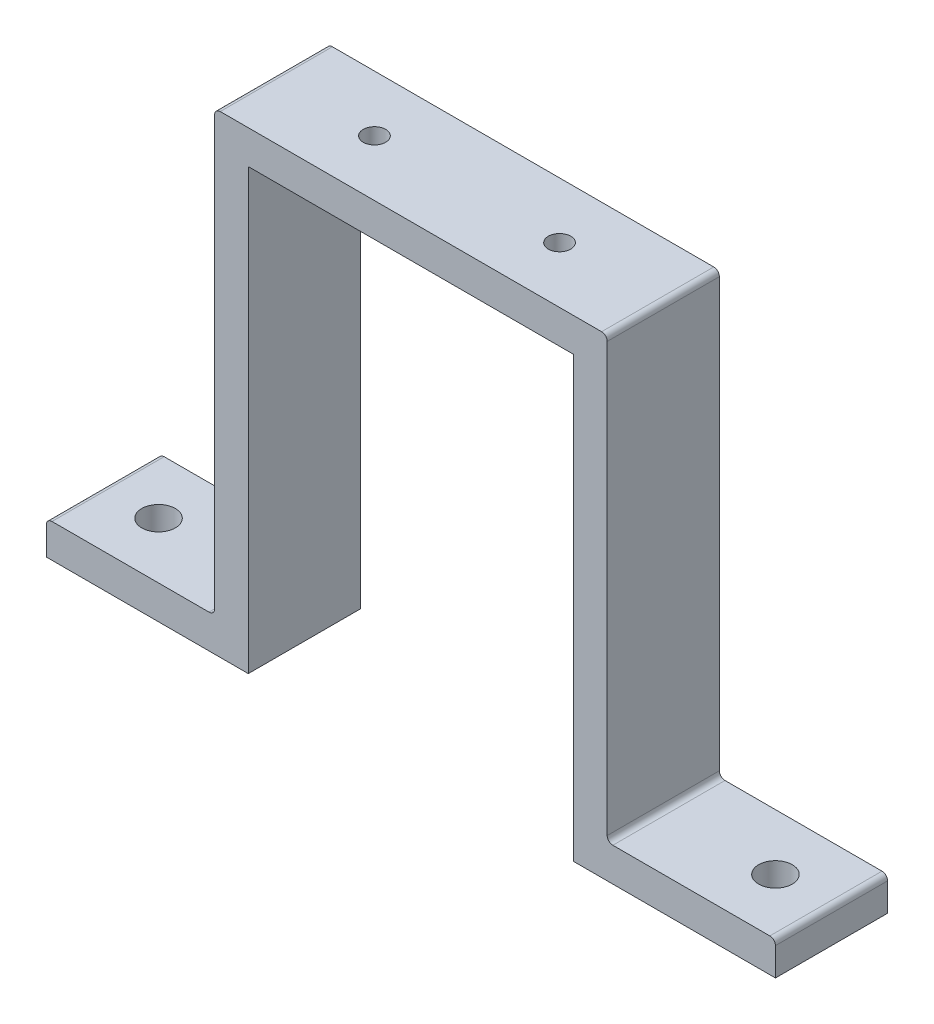
from build123d import *

# Parameters (mm, degrees)
BOSS_EXTRU_3_DEPTH      = 10
ENL_V_MAT_EXTRU_1_REACH = 56.156
ESQUISSE7_R             = 1
ENL_V_MAT_EXTRU_2_REACH = 53.855
ESQUISSE8_R             = 1.5
CONG_8_R                = 0.5


with BuildPart() as part:
    # Esquisse6 → Boss.-Extru.3 (new body)
    with BuildSketch(Plane.XY):
        Polygon((-32.5, -39.15), (-14.5, -39.15), (-14.5, 0), (14.5, 0), (14.5, -39.15), (32.5, -39.15), (32.5, -36.15), (17.5, -36.15), (17.5, 3), (-17.5, 3), (-17.5, -36.15), (-32.5, -36.15), align=None)
    extrude(amount=BOSS_EXTRU_3_DEPTH)

    # Esquisse7 → Enlèv. mat.-Extru.1 (cut, up to next)
    with BuildSketch(Plane(origin=(0, 3, 0), x_dir=(1, 0, 0), z_dir=(0, 1, 0)), mode=Mode.PRIVATE) as enl_v_mat_extru_1_sk1:
        with Locations(Location((-8.25, -5, 0), (0, 0, 180))):
            Circle(ESQUISSE7_R)
    enl_v_mat_extru_1_tool1 = extrude(enl_v_mat_extru_1_sk1.sketch, amount=-ENL_V_MAT_EXTRU_1_REACH, mode=Mode.PRIVATE) & part.part
    # Esquisse7 → Enlèv. mat.-Extru.1 (cut, up to next)
    with BuildSketch(Plane(origin=(0, 3, 0), x_dir=(1, 0, 0), z_dir=(0, 1, 0)), mode=Mode.PRIVATE) as enl_v_mat_extru_1_sk2:
        with Locations(Location((8.25, -5, 0), (0, 0, 180))):
            Circle(ESQUISSE7_R)
    enl_v_mat_extru_1_tool2 = extrude(enl_v_mat_extru_1_sk2.sketch, amount=-ENL_V_MAT_EXTRU_1_REACH, mode=Mode.PRIVATE) & part.part
    add(enl_v_mat_extru_1_tool1.solids().sort_by_distance((-8.25, 3, 5))[0], mode=Mode.SUBTRACT)
    add(enl_v_mat_extru_1_tool2.solids().sort_by_distance((8.25, 3, 5))[0], mode=Mode.SUBTRACT)

    # Esquisse8 → Enlèv. mat.-Extru.2 (cut, up to next)
    with BuildSketch(Plane(origin=(0, -36.15, 0), x_dir=(1, 0, 0), z_dir=(0, 1, 0)), mode=Mode.PRIVATE) as enl_v_mat_extru_2_sk1:
        with Locations(Location((27.5, -5, 0), (0, 0, 180))):
            Circle(ESQUISSE8_R)
    enl_v_mat_extru_2_tool1 = extrude(enl_v_mat_extru_2_sk1.sketch, amount=-ENL_V_MAT_EXTRU_2_REACH, mode=Mode.PRIVATE) & part.part
    # Esquisse8 → Enlèv. mat.-Extru.2 (cut, up to next)
    with BuildSketch(Plane(origin=(0, -36.15, 0), x_dir=(1, 0, 0), z_dir=(0, 1, 0)), mode=Mode.PRIVATE) as enl_v_mat_extru_2_sk2:
        with Locations(Location((-27.5, -5, 0), (0, 0, 180))):
            Circle(ESQUISSE8_R)
    enl_v_mat_extru_2_tool2 = extrude(enl_v_mat_extru_2_sk2.sketch, amount=-ENL_V_MAT_EXTRU_2_REACH, mode=Mode.PRIVATE) & part.part
    add(enl_v_mat_extru_2_tool1.solids().sort_by_distance((27.5, -36.15, 5))[0], mode=Mode.SUBTRACT)
    add(enl_v_mat_extru_2_tool2.solids().sort_by_distance((-27.5, -36.15, 5))[0], mode=Mode.SUBTRACT)

    # Congé8
    cong_8_edges = [part.edges().sort_by_distance(p)[0] for p in [
        (-32.5, -36.15, 5),
        (-17.5, -36.15, 5),
        (-17.5, 3, 5),
        (17.5, 3, 5),
        (17.5, -36.15, 5),
        (32.5, -36.15, 5),
    ]]
    fillet(cong_8_edges, radius=CONG_8_R)


solid = part.part
